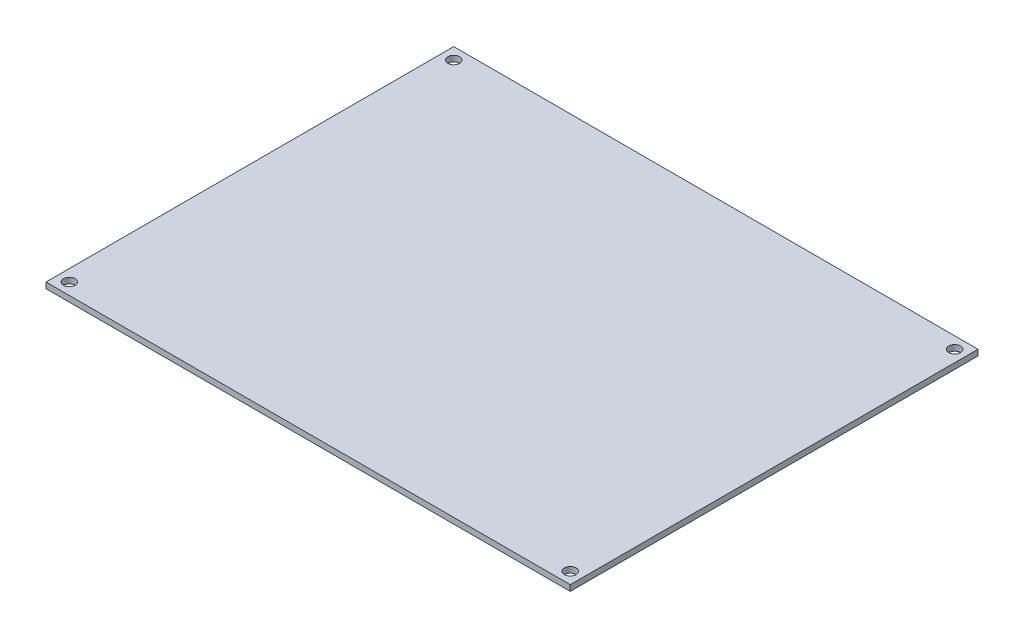
from build123d import *

# Parameters (mm, degrees)
SKETCH1_W           = 90
SKETCH1_H           = 70
BOSS_EXTRUDE1_DEPTH = 1
SKETCH2_R           = 1
CUT_EXTRUDE1_DEPTH  = 10


with BuildPart() as part:
    # Sketch1 → Boss-Extrude1 (new body)
    with BuildSketch(Plane(origin=(0, 0, 0), x_dir=(1, 0, 0), z_dir=(0, 1, 0))):
        with Locations((45, 35)):
            Rectangle(SKETCH1_W, SKETCH1_H)
    extrude(amount=BOSS_EXTRUDE1_DEPTH)

    # Sketch2 → Cut-Extrude1 (cut)
    with BuildSketch(Plane(origin=(0, 1, 0), x_dir=(1, 0, 0), z_dir=(0, 1, 0))):
        with Locations(Location((88, 68, 0), (0, 0, 270))):
            Circle(SKETCH2_R)
        with Locations(Location((88, 2, 0), (0, 0, 270))):
            Circle(SKETCH2_R)
        with Locations(Location((2, 2, 0), (0, 0, 270))):
            Circle(SKETCH2_R)
        with Locations(Location((2, 68, 0), (0, 0, 270))):
            Circle(SKETCH2_R)
    extrude(amount=-CUT_EXTRUDE1_DEPTH, mode=Mode.SUBTRACT)


solid = part.part
